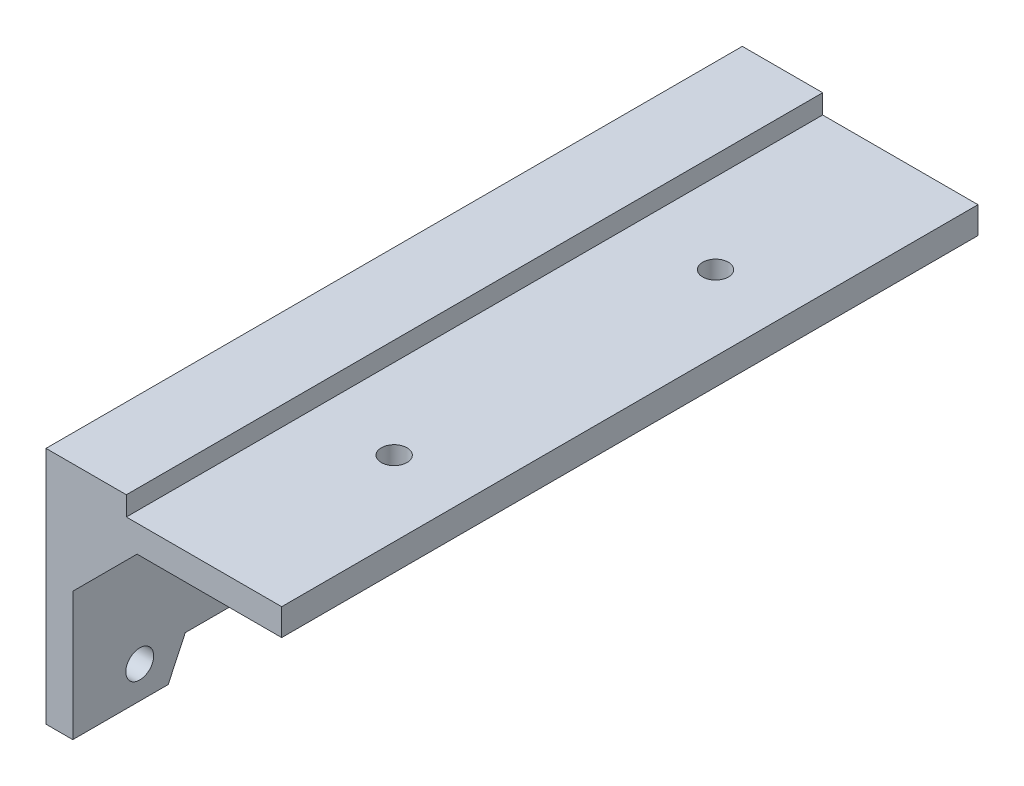
from build123d import *

# Parameters (mm, degrees)
SKETCH1_W           = 82.55
SKETCH1_H           = 26.67
BOSS_EXTRUDE1_DEPTH = 1.5875
SKETCH2_R           = 1.651
SKETCH2_R_2         = 1.5875
CUT_EXTRUDE1_DEPTH  = 3.175
SKETCH5_W           = 82.55
SKETCH5_H           = 3.175
BOSS_EXTRUDE3_DEPTH = 27.94
SKETCH6_R           = 1.524
CUT_EXTRUDE3_DEPTH  = 3.175
CUT_EXTRUDE4_DEPTH  = 3.175
BOSS_EXTRUDE4_DEPTH = 82.55
CUT_EXTRUDE5_DEPTH  = 3.175
SKETCH10_W          = 9.525
SKETCH10_H          = 82.55
BOSS_EXTRUDE5_DEPTH = 2.286


with BuildPart() as part:
    # Sketch1 → Boss-Extrude1 (new, symmetric)
    with BuildSketch(Plane(origin=(0, 0, 0), x_dir=(0, 0, -1), z_dir=(1, 0, 0))):
        Rectangle(SKETCH1_W, SKETCH1_H)
    extrude(amount=BOSS_EXTRUDE1_DEPTH, both=True)

    # Sketch2 → Cut-Extrude1 (cut)
    with BuildSketch(Plane.ZY.offset(1.5875)):
        with Locations((33.3375, -5.715)):
            Circle(SKETCH2_R)
        with Locations((-33.3375, -5.715)):
            Circle(SKETCH2_R)
        with Locations((-26.4795, -10.16)):
            Circle(SKETCH2_R_2)
        with Locations((26.4795, -10.16)):
            Circle(SKETCH2_R_2)
    extrude(amount=-CUT_EXTRUDE1_DEPTH, mode=Mode.SUBTRACT)

    # Sketch5 → Boss-Extrude3 (add)
    with BuildSketch(Plane.ZY.offset(1.5875)):
        with Locations((0, 14.9225)):
            Rectangle(SKETCH5_W, SKETCH5_H)
    extrude(amount=-BOSS_EXTRUDE3_DEPTH)

    # Sketch6 → Cut-Extrude3 (cut)
    with BuildSketch(Plane(origin=(0, 16.51, 0), x_dir=(1, 0, 0), z_dir=(0, 1, 0))):
        with Locations(Location((17.4625, 19.05, 0), (0, 0, 270))):
            Circle(SKETCH6_R)
        with Locations(Location((17.4625, -19.05, 0), (0, 0, 270))):
            Circle(SKETCH6_R)
    extrude(amount=-CUT_EXTRUDE3_DEPTH, mode=Mode.SUBTRACT)

    # Sketch7 → Cut-Extrude4 (cut)
    with BuildSketch(Plane.ZY.offset(1.5875)):
        Polygon((-31.75, -13.335), (31.75, -13.335), (27.94, -5.207), (-27.94, -5.207), align=None)
    extrude(amount=-CUT_EXTRUDE4_DEPTH, mode=Mode.SUBTRACT)

    # Sketch8 → Boss-Extrude4 (add)
    with BuildSketch(Plane.XY.offset(41.275)):
        Polygon((1.5875, 13.335), (9.2075, 13.335), (1.5875, 5.715), align=None)
    extrude(amount=-BOSS_EXTRUDE4_DEPTH)

    # Sketch9 → Cut-Extrude5 (cut)
    with BuildSketch(Plane.ZY.offset(1.5875)):
        Polygon((-41.275, -13.335), (-41.275, -9.525), (-29.9640625, -9.525), (-31.75, -13.335), align=None)
        Polygon((41.275, -13.335), (41.275, -9.525), (29.9640625, -9.525), (31.75, -13.335), align=None)
    extrude(amount=-CUT_EXTRUDE5_DEPTH, mode=Mode.SUBTRACT)

    # Sketch10 → Boss-Extrude5 (add)
    with BuildSketch(Plane(origin=(0, 16.51, 0), x_dir=(1, 0, 0), z_dir=(0, 1, 0))):
        with Locations((3.175, 0)):
            Rectangle(SKETCH10_W, SKETCH10_H)
    extrude(amount=BOSS_EXTRUDE5_DEPTH)


solid = part.part
